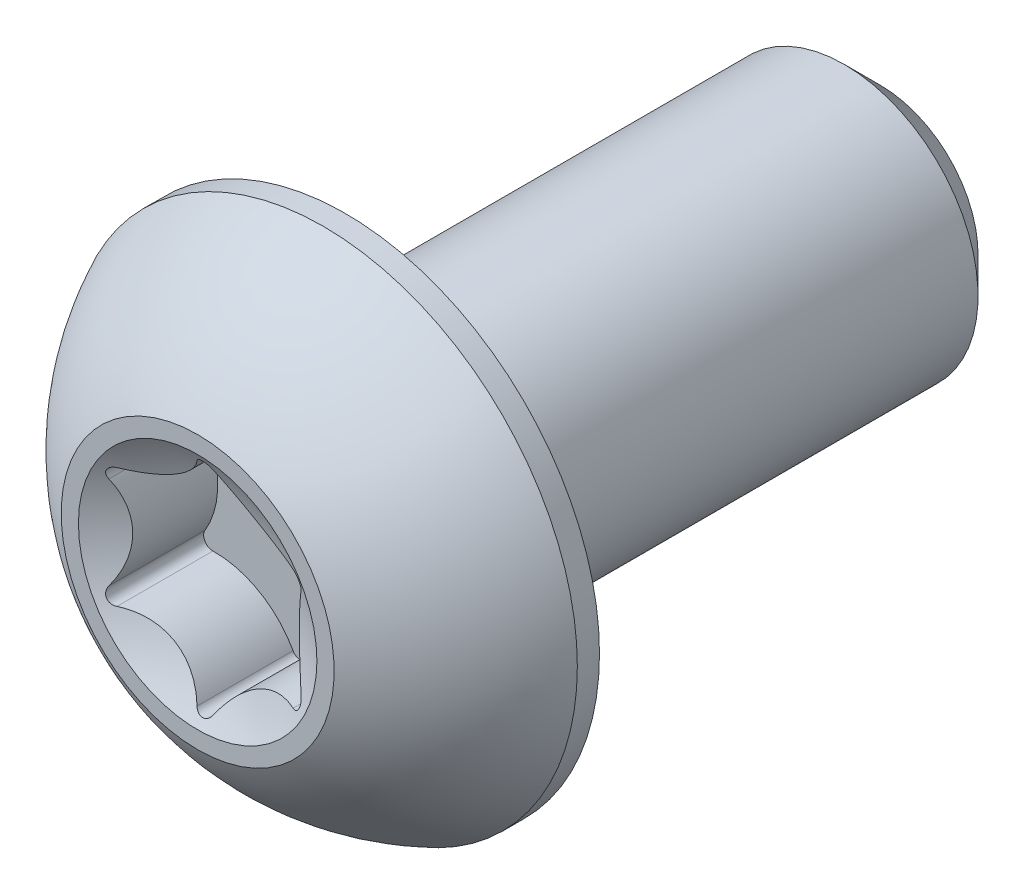
from build123d import *
from build123d.topology import SkipClean

# Parameters (mm, degrees)
CUT_EXTRUDE1_DEPTH = 0.966
CIRPATTERN1_COUNT  = 6


with BuildPart() as part:
    # Sketch2 → Revolve1 (revolve)
    with BuildSketch(Plane(origin=(0, 0, 0), x_dir=(0, 0, -1), z_dir=(1, 0, 0))):
        Polygon((1.38, 1.25), (6.0425, 1.25), (6.38, 0.9125), (6.38, 0), (1.38, 0), align=None)
    revolve(axis=Axis((0, 0, -6.38), (0, 0, 1)))


with BuildPart() as body_2:
    # Sketch3 → Revolve2 (revolve)
    with BuildSketch(Plane(origin=(0, 0, 0), x_dir=(0, 0, -1), z_dir=(1, 0, 0))):
        with BuildLine():
            Line((1.38, 0), (1.38, 2.375))
            Line((1.38, 2.375), (1.173, 2.375))
            ThreePointArc((1.173, 2.375), (0.500332222, 1.917105021), (0, 1.275375))
            Line((0, 1.275375), (0, 0))
            Line((0, 0), (1.38, 0))
        make_face()
    revolve(axis=Axis((0, 0, 0), (0, 0, -1)))

    # Combine1: union part
    add(part.part)

    # Sketch4 → Cut-Extrude1 (cut)
    with BuildSketch(Plane.XY):
        with BuildLine():
            Line((0, 0), (-0.898826116, 0.5189375))
            ThreePointArc((-0.898826116, 0.5189375), (-0.910259221, 0.475549675), (-0.89810803, 0.432357455))
            ThreePointArc((-0.89810803, 0.432357455), (-0.77840625, 0), (-0.89810803, -0.432357455))
            ThreePointArc((-0.89810803, -0.432357455), (-0.910259221, -0.475549675), (-0.898826116, -0.5189375))
            Line((-0.898826116, -0.5189375), (0, 0))
        make_face()
    cut_extrude1 = extrude(amount=-CUT_EXTRUDE1_DEPTH, mode=Mode.SUBTRACT)

    # CirPattern1: Cut-Extrude1 ×6 about axis
    cirpattern1_axis = Axis((0, 0, -6.38), (0, 0, -1))
    for i in range(1, CIRPATTERN1_COUNT):
        add(cut_extrude1.rotate(cirpattern1_axis, i * 360 / CIRPATTERN1_COUNT), mode=Mode.SUBTRACT)

    # Sketch5 → Cut-Revolve1 (revolve, cut)
    with SkipClean():  # the faces are left unmerged after this step: merging them gives an invalid solid
        with BuildSketch(Plane(origin=(0, 0, 0), x_dir=(0, 0, -1), z_dir=(1, 0, 0))):
            with BuildLine():
                Line((-1.767310001, 2.089310001), (-1.767310001, -2.089310001))
                ThreePointArc((-1.767310001, -2.089310001), (0.322, 0), (-1.767310001, 2.089310001))
            make_face()
        revolve(axis=Axis((0, 2.089310001, 1.767310001), (0, -1, 0)), mode=Mode.SUBTRACT)


solid = body_2.part
